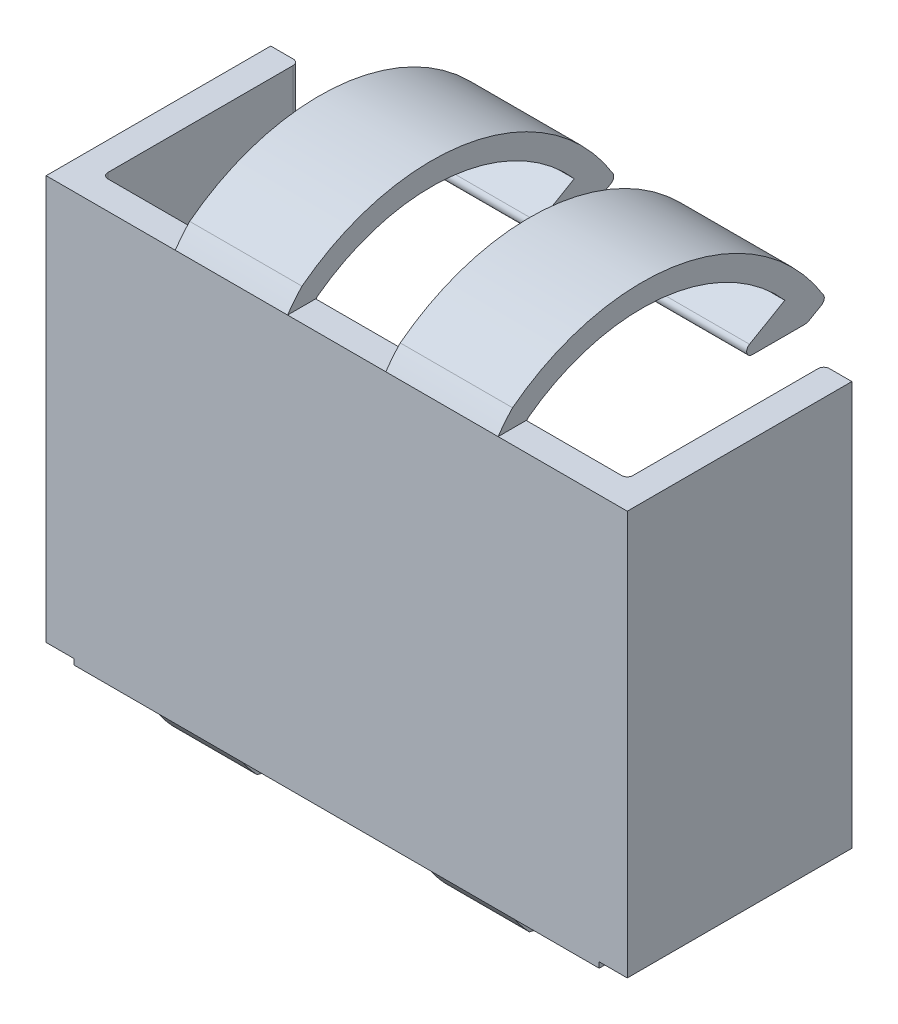
from build123d import *

# Parameters (mm, degrees)
SKETCH1_W           = 93.5
SKETCH1_H           = 73
BOSS_EXTRUDE1_DEPTH = 5
BOSS_EXTRUDE3_START = -18
BOSS_EXTRUDE3_DEPTH = 20
SKETCH3_W           = 40
SKETCH3_H           = 72
BOSS_EXTRUDE4_DEPTH = 5
FILLET2_R           = 1
BOSS_EXTRUDE5_START = -15
BOSS_EXTRUDE5_DEPTH = 15


with BuildPart() as part:
    # Sketch1 → Boss-Extrude1 (new body)
    with BuildSketch(Plane.XY):
        Rectangle(SKETCH1_W, SKETCH1_H)
    extrude(amount=BOSS_EXTRUDE1_DEPTH)

    # Sketch2 → Boss-Extrude3 (add)
    with BuildSketch(Plane(origin=(46.75, 0, 0), x_dir=(0, 0, -1), z_dir=(1, 0, 0)).offset(BOSS_EXTRUDE3_START)):
        with BuildLine():
            ThreePointArc((-2.434820811, 39.673585924), (-3.782270226, 38.139218536), (-5, 36.5))
            Line((-5, 36.5), (0, 36.5))
            Line((0, 36.5), (0, 36.002201306))
            ThreePointArc((0, 36.002201306), (0.106466288, 36.451197416), (0.403195013, 36.804587627))
            ThreePointArc((0.403195013, 36.804587627), (24.169553289, 43.313947092), (46.060330973, 32))
            Line((46.060330973, 32), (39.766102339, 28.366025404))
            ThreePointArc((39.766102339, 28.366025404), (39.300176512, 27.241180955), (40.266102339, 26.5))
            Line((40.266102339, 26.5), (49.466267311, 26.5))
            ThreePointArc((49.466267311, 26.5), (49.981952839, 26.567626217), (50.462764505, 26.765931563))
            Line((50.462764505, 26.765931563), (52.589346112, 27.987989793))
            ThreePointArc((52.589346112, 27.987989793), (53.05994511, 28.607366306), (52.944303456, 29.376598189))
            ThreePointArc((52.944303456, 29.376598189), (27.548560845, 46.861682099), (-2.434820811, 39.673585924))
        make_face()
    boss_extrude3 = extrude(amount=-BOSS_EXTRUDE3_DEPTH)

    # Mirror1: Boss-Extrude3 across plane
    add(boss_extrude3.mirror(Plane(origin=(0, 0, 0), x_dir=(0, 0, 1), z_dir=(1, 0, 0))))

    # Sketch3 → Boss-Extrude4 (add)
    with BuildSketch(Plane(origin=(46.75, 0, 0), x_dir=(0, 0, -1), z_dir=(1, 0, 0))):
        with Locations((15, 0.5)):
            Rectangle(SKETCH3_W, SKETCH3_H)
    boss_extrude4 = extrude(amount=BOSS_EXTRUDE4_DEPTH)

    # Mirror3: Boss-Extrude4 across plane
    add(boss_extrude4.mirror(Plane(origin=(0, 0, 0), x_dir=(0, 0, 1), z_dir=(1, 0, 0))))

    # Fillet2
    fillet2_edges = [part.edges().sort_by_distance(p)[0] for p in [
        (46.75, 0.5, -35),
        (-46.75, 0.5, -35),
        (-46.75, 0.5, 0),
        (46.75, 0.5, 0),
    ]]
    fillet(fillet2_edges, radius=FILLET2_R)

    # Sketch2<5> → Boss-Extrude5 (add)
    with BuildSketch(Plane(origin=(46.75, 0, 0), x_dir=(0, 0, -1), z_dir=(1, 0, 0)).offset(BOSS_EXTRUDE5_START)):
        with BuildLine():
            ThreePointArc((0.403195013, -36.804587627), (0.106466288, -36.451197416), (0, -36.002201306))
            Line((0, -36.002201306), (0, -36.5))
            Line((0, -36.5), (-5, -36.5))
            ThreePointArc((-5, -36.5), (-3.782270226, -38.139218536), (-2.434820811, -39.673585924))
            ThreePointArc((-2.434820811, -39.673585924), (23.559962361, -44.796829736), (50, -46.5))
            Line((50, -46.5), (50, -43.5))
            ThreePointArc((50, -43.5), (24.995023445, -41.682507765), (0.403195013, -36.804587627))
        make_face()
    boss_extrude5 = extrude(amount=-BOSS_EXTRUDE5_DEPTH)

    # Mirror4: Boss-Extrude5 across plane
    add(boss_extrude5.mirror(Plane(origin=(0, 0, 0), x_dir=(0, 0, 1), z_dir=(1, 0, 0))))


solid = part.part
